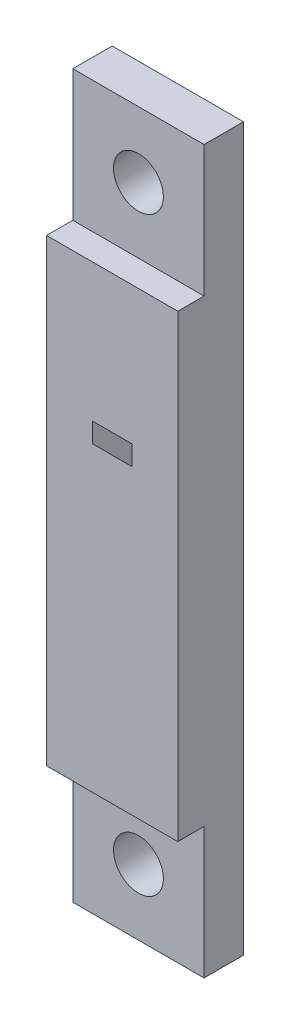
from build123d import *

# Parameters (mm, degrees)
SKETCH1_W           = 10
SKETCH1_H           = 55
SKETCH1_W_2         = 4.5
SKETCH1_H_2         = 4
SKETCH1_H_3         = 2
BOSS_EXTRUDE2_DEPTH = 5
SKETCH2_W           = 5
SKETCH2_H           = 10
SKETCH2_W_2         = 10
CUT_EXTRUDE1_DEPTH  = 2
CUT_EXTRUDE2_DEPTH  = 30.223335826
SKETCH4_W           = 3
SKETCH4_H           = 2
CUT_EXTRUDE3_DEPTH  = 1.5
CUT_EXTRUDE4_DEPTH  = 3


with BuildPart() as part:
    # Sketch1 → Boss-Extrude2 (new body)
    # profile 1 of 3: a face of its own
    with BuildSketch(Plane.XY.offset(13.5)):
        with Locations((-4.4209, 0)):
            Rectangle(SKETCH1_W, SKETCH1_H)
        with Locations((-4.4209, 0)):
            Rectangle(SKETCH1_W_2, SKETCH1_H_2, mode=Mode.SUBTRACT)
    # profile 2 of 3: a face of its own
    with BuildSketch(Plane.XY.offset(13.5)):
        with Locations((-4.4209, -1)):
            Rectangle(SKETCH1_W_2, SKETCH1_H_3)
    # profile 3 of 3: a face of its own
    with BuildSketch(Plane.XY.offset(13.5)):
        with Locations((-4.4209, 1)):
            Rectangle(SKETCH1_W_2, SKETCH1_H_3)
    extrude(amount=BOSS_EXTRUDE2_DEPTH)

    # Sketch2 → Cut-Extrude1 (cut)
    with BuildSketch(Plane.XY.offset(18.5)):
        with Locations((-6.9209, 22.5)):
            Rectangle(SKETCH2_W, SKETCH2_H)
        with Locations((-1.9209, 22.5)):
            Rectangle(SKETCH2_W, SKETCH2_H)
        with Locations((-4.4209, -22.5)):
            Rectangle(SKETCH2_W_2, SKETCH2_H)
    extrude(amount=-CUT_EXTRUDE1_DEPTH, mode=Mode.SUBTRACT)

    # Sketch3 → Cut-Extrude2 (cut, through all)
    with BuildSketch(Plane.XY.offset(16.5)):
        with BuildLine():
            ThreePointArc((-2.5209, 22.5), (-3.077397116, 23.843502884), (-4.4209, 24.4))
            Line((-4.4209, 24.4), (-4.4209, 20.6))
            ThreePointArc((-4.4209, 20.6), (-3.077397116, 21.156497116), (-2.5209, 22.5))
        make_face()
        with BuildLine():
            Line((-4.4209, 20.6), (-4.4209, 24.4))
            ThreePointArc((-4.4209, 24.4), (-6.3209, 22.5), (-4.4209, 20.6))
        make_face()
        with BuildLine():
            ThreePointArc((-2.5209, -22.5), (-3.077397116, -21.156497116), (-4.4209, -20.6))
            Line((-4.4209, -20.6), (-4.4209, -24.4))
            ThreePointArc((-4.4209, -24.4), (-3.077397116, -23.843502884), (-2.5209, -22.5))
        make_face()
        with BuildLine():
            Line((-4.4209, -24.4), (-4.4209, -20.6))
            ThreePointArc((-4.4209, -20.6), (-6.3209, -22.5), (-4.4209, -24.4))
        make_face()
    extrude(amount=-CUT_EXTRUDE2_DEPTH, mode=Mode.SUBTRACT)

    # Sketch4 → Cut-Extrude3 (cut)
    with BuildSketch(Plane(origin=(0, 0, 13.5), x_dir=(-1, 0, 0), z_dir=(0, 0, -1))):
        with Locations((4.4209, -1)):
            Rectangle(SKETCH4_W, SKETCH4_H)
        with Locations((4.4209, 1)):
            Rectangle(SKETCH4_W, SKETCH4_H)
    extrude(amount=-CUT_EXTRUDE3_DEPTH, mode=Mode.SUBTRACT)

    # Sketch5 → Cut-Extrude4 (cut)
    with BuildSketch(Plane.ZY.offset(2.9209)):
        Polygon((18.5, 7), (18.5, 5.5), (15, 2), (13.5, 2), align=None)
    extrude(amount=CUT_EXTRUDE4_DEPTH, mode=Mode.SUBTRACT)


solid = part.part
